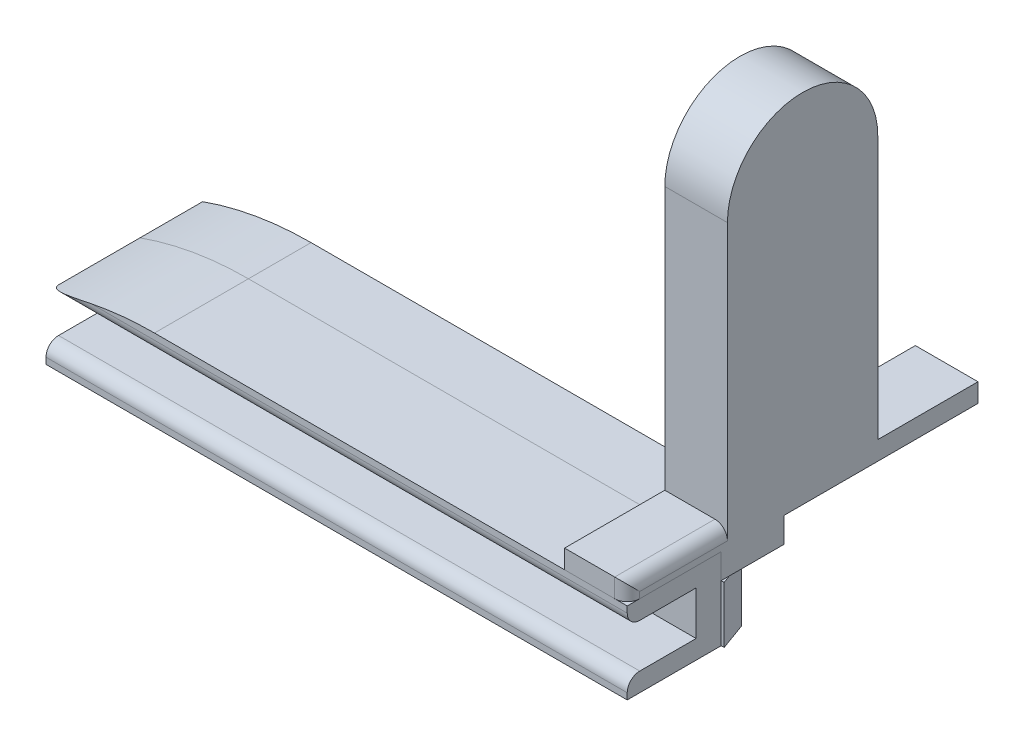
from build123d import *

# Parameters (mm, degrees)
SKETCH1_W           = 65
SKETCH1_H           = 2
BOSS_EXTRUDE1_DEPTH = 6.5
BOSS_EXTRUDE2_DEPTH = 4.5
SKETCH5_W           = 67
SKETCH5_H           = 1.5
BOSS_EXTRUDE6_DEPTH = 5.5
BOSS_EXTRUDE7_DEPTH = 5
SKETCH7_W           = 65
SKETCH7_H           = 2
BOSS_EXTRUDE8_DEPTH = 5
SKETCH8_W           = 31.428674942
SKETCH8_H           = 29.09091251
CUT_EXTRUDE1_DEPTH  = 80.232704839
CUT_EXTRUDE2_DEPTH  = 64.693313851
FILLET5_R           = 1
FILLET7_R           = 1


with BuildPart() as part:
    # Sketch1 → Boss-Extrude1 (new body)
    with BuildSketch(Plane(origin=(0, 0, 0), x_dir=(1, 0, 0), z_dir=(0, 1, 0))):
        with Locations((-31.358656154, 5.24806396)):
            Rectangle(SKETCH1_W, SKETCH1_H)
    extrude(amount=BOSS_EXTRUDE1_DEPTH)

    # Sketch2 → Boss-Extrude2 (add)
    with BuildSketch(Plane(origin=(0, 0, 0), x_dir=(1, 0, 0), z_dir=(0, 1, 0))):
        Polygon((-63.058656154, 8.44806396), (-63.858656154, 6.24806396), (-61.418656154, 6.24806396), (-62.218656154, 8.44806396), align=None)
        Polygon((-59.918656154, 8.44806396), (-60.718656154, 6.24806396), (-58.278656154, 6.24806396), (-59.078656154, 8.44806396), align=None)
        Polygon((-56.778656154, 8.44806396), (-57.578656154, 6.24806396), (-55.138656154, 6.24806396), (-55.938656154, 8.44806396), align=None)
        Polygon((-53.638656154, 8.44806396), (-54.438656154, 6.24806396), (-51.998656154, 6.24806396), (-52.798656154, 8.44806396), align=None)
        Polygon((-50.498656154, 8.44806396), (-51.298656154, 6.24806396), (-48.858656154, 6.24806396), (-49.658656154, 8.44806396), align=None)
        Polygon((-47.358656154, 8.44806396), (-48.158656154, 6.24806396), (-45.718656154, 6.24806396), (-46.518656154, 8.44806396), align=None)
        Polygon((-44.218656154, 8.44806396), (-45.018656154, 6.24806396), (-42.578656154, 6.24806396), (-43.378656154, 8.44806396), align=None)
        Polygon((-41.078656154, 8.44806396), (-41.878656154, 6.24806396), (-39.438656154, 6.24806396), (-40.238656154, 8.44806396), align=None)
        Polygon((-37.938656154, 8.44806396), (-38.738656154, 6.24806396), (-36.298656154, 6.24806396), (-37.098656154, 8.44806396), align=None)
        Polygon((-34.798656154, 8.44806396), (-35.598656154, 6.24806396), (-33.158656154, 6.24806396), (-33.958656154, 8.44806396), align=None)
        Polygon((-31.658656154, 8.44806396), (-32.458656154, 6.24806396), (-30.018656154, 6.24806396), (-30.818656154, 8.44806396), align=None)
        Polygon((-29.318656154, 6.24806396), (-26.878656154, 6.24806396), (-27.678656154, 8.44806396), (-28.518656154, 8.44806396), align=None)
        Polygon((-26.178656154, 6.24806396), (-23.738656154, 6.24806396), (-24.538656154, 8.44806396), (-25.378656154, 8.44806396), align=None)
        Polygon((-23.038656154, 6.24806396), (-20.598656154, 6.24806396), (-21.398656154, 8.44806396), (-22.238656154, 8.44806396), align=None)
        Polygon((-19.898656154, 6.24806396), (-17.458656154, 6.24806396), (-18.258656154, 8.44806396), (-19.098656154, 8.44806396), align=None)
        Polygon((-16.758656154, 6.24806396), (-14.318656154, 6.24806396), (-15.118656154, 8.44806396), (-15.958656154, 8.44806396), align=None)
        Polygon((-13.618656154, 6.24806396), (-11.178656154, 6.24806396), (-11.978656154, 8.44806396), (-12.818656154, 8.44806396), align=None)
        Polygon((-10.478656154, 6.24806396), (-8.038656154, 6.24806396), (-8.838656154, 8.44806396), (-9.678656154, 8.44806396), align=None)
        Polygon((-7.338656154, 6.24806396), (-4.898656154, 6.24806396), (-5.698656154, 8.44806396), (-6.538656154, 8.44806396), align=None)
        Polygon((-4.198656154, 6.24806396), (-1.758656154, 6.24806396), (-2.558656154, 8.44806396), (-3.398656154, 8.44806396), align=None)
        Polygon((-3.398656154, 8.44806396), (-4.198656154, 6.24806396), (-1.758656154, 6.24806396), (-2.558656154, 8.44806396), align=None)
        Polygon((-0.258656154, 8.44806396), (-1.058656154, 6.24806396), (1.141343846, 6.24806396), (1.381343846, 6.24806396), (0.581343846, 8.44806396), align=None)
        Polygon((-6.538656154, 8.44806396), (-7.338656154, 6.24806396), (-4.898656154, 6.24806396), (-5.698656154, 8.44806396), align=None)
        Polygon((-9.678656154, 8.44806396), (-10.478656154, 6.24806396), (-8.038656154, 6.24806396), (-8.838656154, 8.44806396), align=None)
        Polygon((-12.818656154, 8.44806396), (-13.618656154, 6.24806396), (-11.178656154, 6.24806396), (-11.978656154, 8.44806396), align=None)
        Polygon((-15.958656154, 8.44806396), (-16.758656154, 6.24806396), (-14.318656154, 6.24806396), (-15.118656154, 8.44806396), align=None)
        Polygon((-19.098656154, 8.44806396), (-19.898656154, 6.24806396), (-17.458656154, 6.24806396), (-18.258656154, 8.44806396), align=None)
        Polygon((-22.238656154, 8.44806396), (-23.038656154, 6.24806396), (-20.598656154, 6.24806396), (-21.398656154, 8.44806396), align=None)
        Polygon((-25.378656154, 8.44806396), (-26.178656154, 6.24806396), (-23.738656154, 6.24806396), (-24.538656154, 8.44806396), align=None)
        Polygon((-28.518656154, 8.44806396), (-29.318656154, 6.24806396), (-26.878656154, 6.24806396), (-27.678656154, 8.44806396), align=None)
    extrude(amount=BOSS_EXTRUDE2_DEPTH)

    # Sketch5 → Boss-Extrude6 (add)
    with BuildSketch(Plane.XY.offset(-4.24806396)):
        with Locations((-32.358656154, 0.75)):
            Rectangle(SKETCH5_W, SKETCH5_H)
        with Locations((-32.358656154, 5.75)):
            Rectangle(SKETCH5_W, SKETCH5_H)
    extrude(amount=BOSS_EXTRUDE6_DEPTH)


with BuildPart() as body_2:
    # Sketch6 → Boss-Extrude7 (new body)
    with BuildSketch(Plane(origin=(1.141343846, 0, 0), x_dir=(0, 0, -1), z_dir=(1, 0, 0))):
        with BuildLine():
            Line((-1.25193604, 6.5), (6.24806396, 6.5))
            Line((6.24806396, 6.5), (26.74806396, 6.5))
            Line((26.74806396, 6.5), (26.74806396, 8))
            Line((26.74806396, 8), (18.74806396, 8))
            Line((18.74806396, 8), (18.74806396, 29))
            ThreePointArc((18.74806396, 29), (12.74806396, 35), (6.74806396, 29))
            Line((6.74806396, 29), (6.74806396, 8))
            Line((6.74806396, 8), (-1.25193604, 8))
            Line((-1.25193604, 8), (-1.25193604, 6.5))
        make_face()
    extrude(amount=-BOSS_EXTRUDE7_DEPTH)

    # Sketch7 → Boss-Extrude8 (add)
    with BuildSketch(Plane(origin=(0, 0, -6.24806396), x_dir=(-1, 0, 0), z_dir=(0, 0, -1))):
        with Locations((31.358656154, 5.5)):
            Rectangle(SKETCH7_W, SKETCH7_H)
    extrude(amount=BOSS_EXTRUDE8_DEPTH)


with BuildPart() as cut_extrude1_tool:
    # Sketch8 → Cut-Extrude1 (new, through all)
    with BuildSketch(Plane(origin=(0, 0, 0), x_dir=(-1, 0, 0), z_dir=(0, -1, 0))):
        with Locations((60.967384102, 5.403519831)):
            Rectangle(SKETCH8_W, SKETCH8_H)
    extrude(amount=-CUT_EXTRUDE1_DEPTH)


with BuildPart() as part_1:
    add(part.part)

    # Cut-Extrude1: cut by cut_extrude1_tool
    add(cut_extrude1_tool.part, mode=Mode.SUBTRACT)


with BuildPart() as body_2_1:
    add(body_2.part)

    # Cut-Extrude1: cut by cut_extrude1_tool
    add(cut_extrude1_tool.part, mode=Mode.SUBTRACT)


with BuildPart() as cut_extrude2_tool:
    # Sketch10 → Cut-Extrude2 (new, through all)
    with BuildSketch(Plane.XY.offset(1.25193604)):
        with BuildLine():
            Line((-45.253046631, 6.5), (-45.253046631, 5))
            ThreePointArc((-45.253046631, 5), (-40.987678702, 6.122228556), (-36.593358591, 6.5))
            Line((-36.593358591, 6.5), (-45.253046631, 6.5))
        make_face()
    extrude(amount=-CUT_EXTRUDE2_DEPTH)


with BuildPart() as part_2:
    add(part_1.part)

    # Cut-Extrude2: cut by cut_extrude2_tool
    add(cut_extrude2_tool.part, mode=Mode.SUBTRACT)

    # Fillet7
    fillet7_edges = [part_2.edges().sort_by_distance(p)[0] for p in [
        (-22.055851393, 5, 1.25193604),
        (-22.055851393, 1.5, 1.25193604),
    ]]
    fillet(fillet7_edges, radius=FILLET7_R)


with BuildPart() as body_2_2:
    add(body_2_1.part)

    # Cut-Extrude2: cut by cut_extrude2_tool
    add(cut_extrude2_tool.part, mode=Mode.SUBTRACT)

    # Fillet5
    fillet5_edges = [body_2_2.edges().sort_by_distance(p)[0] for p in [
        (1.141343846, 7.25, 1.25193604),
        (1.141343846, 8, -2.74806396),
    ]]
    fillet(fillet5_edges, radius=FILLET5_R)


solid = Compound([part_2.part, body_2_2.part])
